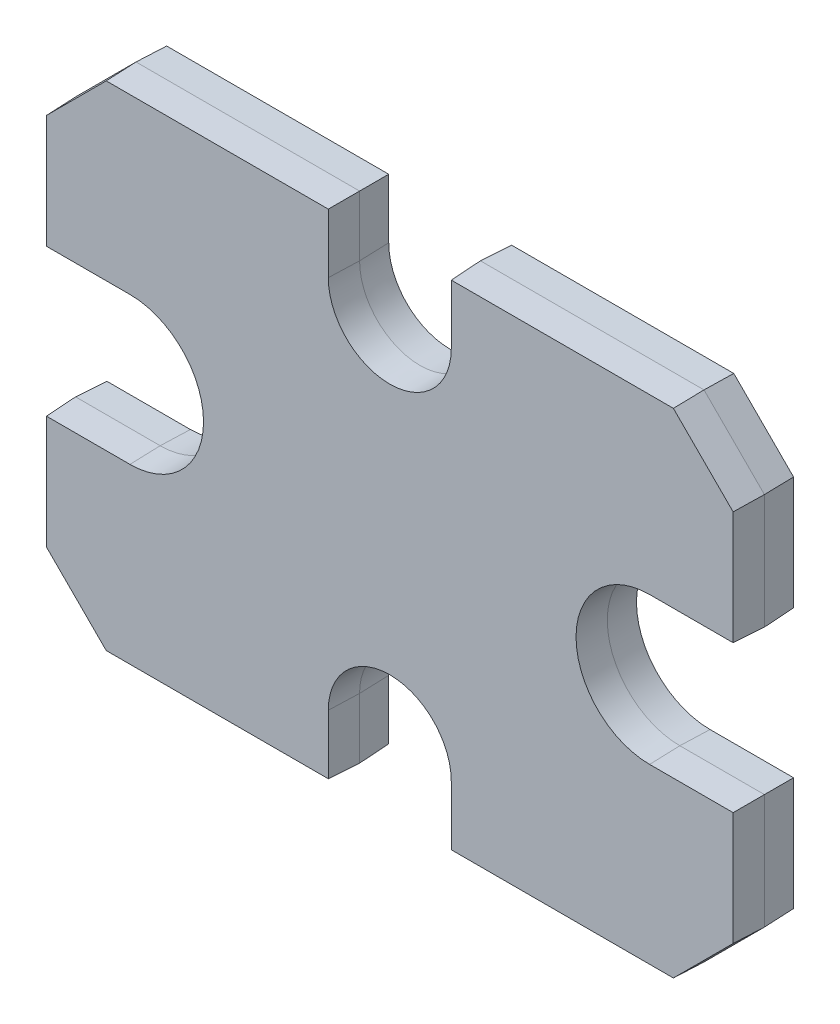
from build123d import *

# Parameters (mm, degrees)
BOSS_EXTRUDE1_DEPTH           = 5
BOSS_EXTRUDE1_TAPER           = 2
BOSS_EXTRUDE1_OTHER_WAY_DEPTH = 5
BOSS_EXTRUDE1_OTHER_WAY_TAPER = 2


with BuildPart() as part:
    # Sketch1 → Boss-Extrude1 (new body)
    with BuildSketch(Plane.XY):
        with BuildLine():
            Line((47, 41), (10, 41))
            Line((10, 41), (10, 31))
            ThreePointArc((10, 31), (0, 21), (-10, 31))
            Line((-10, 31), (-10, 41))
            Line((-10, 41), (-47, 41))
            Line((-47, 41), (-57, 31))
            Line((-57, 31), (-57, 12))
            Line((-57, 12), (-43, 12))
            ThreePointArc((-43, 12), (-31, 0), (-43, -12))
            Line((-43, -12), (-57, -12))
            Line((-57, -12), (-57, -31))
            Line((-57, -31), (-47, -41))
            Line((-47, -41), (-10, -41))
            Line((-10, -41), (-10, -31))
            ThreePointArc((-10, -31), (0, -21), (10, -31))
            Line((10, -31), (10, -41))
            Line((10, -41), (47, -41))
            Line((47, -41), (57, -31))
            Line((57, -31), (57, -12))
            Line((57, -12), (43, -12))
            ThreePointArc((43, -12), (31, 0), (43, 12))
            Line((43, 12), (57, 12))
            Line((57, 12), (57, 31))
            Line((57, 31), (47, 41))
        make_face()
    extrude(amount=BOSS_EXTRUDE1_DEPTH, taper=BOSS_EXTRUDE1_TAPER)

    # Sketch1 → Boss-Extrude1 other way (add)
    with BuildSketch(Plane.XY):
        with BuildLine():
            Line((47, 41), (10, 41))
            Line((10, 41), (10, 31))
            ThreePointArc((10, 31), (0, 21), (-10, 31))
            Line((-10, 31), (-10, 41))
            Line((-10, 41), (-47, 41))
            Line((-47, 41), (-57, 31))
            Line((-57, 31), (-57, 12))
            Line((-57, 12), (-43, 12))
            ThreePointArc((-43, 12), (-31, 0), (-43, -12))
            Line((-43, -12), (-57, -12))
            Line((-57, -12), (-57, -31))
            Line((-57, -31), (-47, -41))
            Line((-47, -41), (-10, -41))
            Line((-10, -41), (-10, -31))
            ThreePointArc((-10, -31), (0, -21), (10, -31))
            Line((10, -31), (10, -41))
            Line((10, -41), (47, -41))
            Line((47, -41), (57, -31))
            Line((57, -31), (57, -12))
            Line((57, -12), (43, -12))
            ThreePointArc((43, -12), (31, 0), (43, 12))
            Line((43, 12), (57, 12))
            Line((57, 12), (57, 31))
            Line((57, 31), (47, 41))
        make_face()
    extrude(amount=-BOSS_EXTRUDE1_OTHER_WAY_DEPTH, taper=BOSS_EXTRUDE1_OTHER_WAY_TAPER)


solid = part.part
